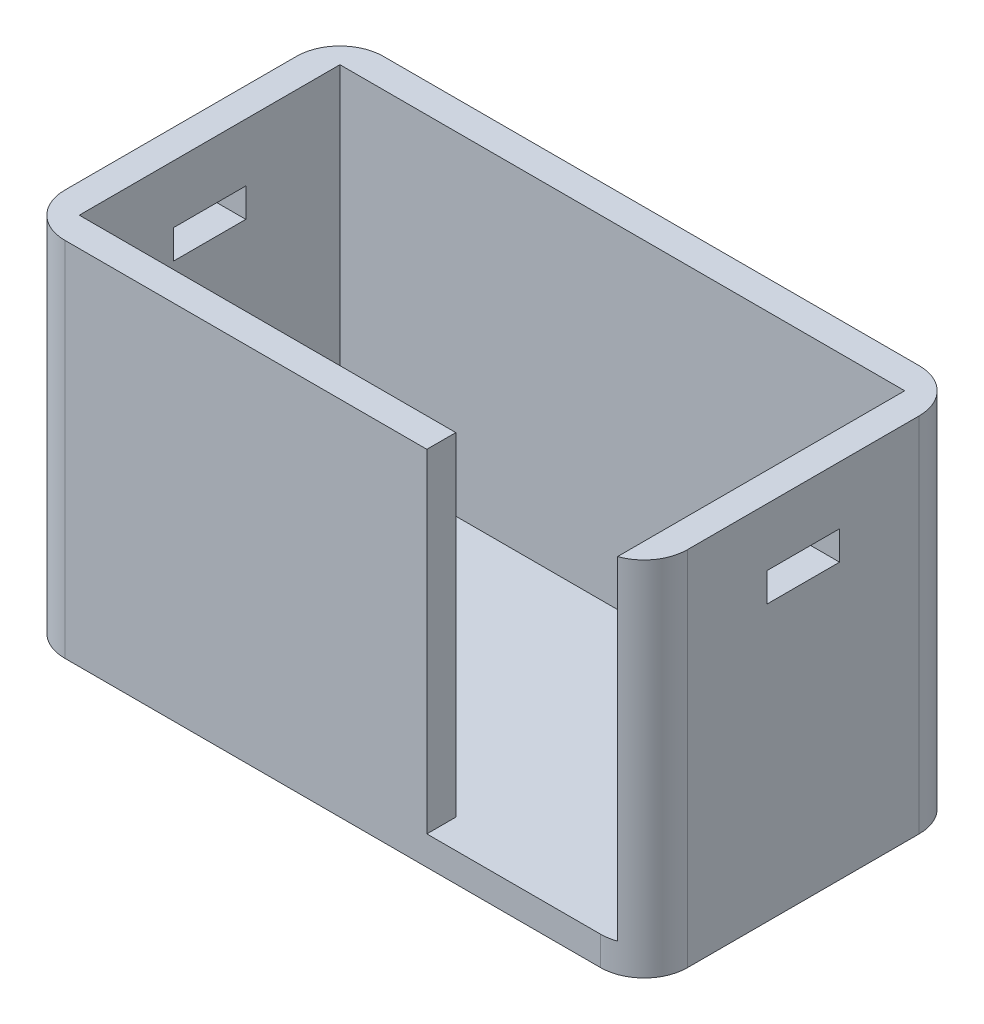
from build123d import *

# Parameters (mm, degrees)
SKETCH1_W           = 43
SKETCH1_H           = 25
SKETCH1_W_2         = 39
SKETCH1_H_2         = 21
BOSS_EXTRUDE1_DEPTH = 18
SKETCH2_W           = 43
SKETCH2_H           = 25
BOSS_EXTRUDE2_DEPTH = 2
SKETCH3_W           = 43
SKETCH3_H           = 20
CUT_EXTRUDE1_DEPTH  = 2
SKETCH5_W           = 28
SKETCH5_H           = 23
BOSS_EXTRUDE3_DEPTH = 2
SKETCH7_W           = 5
SKETCH7_H           = 2
CUT_EXTRUDE3_DEPTH  = 57.5
BOSS_EXTRUDE4_DEPTH = 2
BOSS_EXTRUDE5_DEPTH = 2
SKETCH18_R          = 1.25
CUT_EXTRUDE4_DEPTH  = 2
FILLET4_R           = 3
FILLET5_R           = 3


with BuildPart() as part:
    # Sketch1 → Boss-Extrude1 (new body)
    with BuildSketch(Plane.XY):
        with Locations((19.5, -10.5)):
            Rectangle(SKETCH1_W, SKETCH1_H)
        with Locations((19.5, -10.5)):
            Rectangle(SKETCH1_W_2, SKETCH1_H_2, mode=Mode.SUBTRACT)
    extrude(amount=BOSS_EXTRUDE1_DEPTH)

    # Sketch2 → Boss-Extrude2 (add)
    with BuildSketch(Plane(origin=(0, 0, 0), x_dir=(-1, 0, 0), z_dir=(0, 0, -1))):
        with Locations((-19.5, -10.5)):
            Rectangle(SKETCH2_W, SKETCH2_H)
    extrude(amount=BOSS_EXTRUDE2_DEPTH)

    # Sketch3 → Cut-Extrude1 (cut)
    with BuildSketch(Plane(origin=(0, 2, 0), x_dir=(1, 0, 0), z_dir=(0, 1, 0))):
        with Locations((19.5, -8)):
            Rectangle(SKETCH3_W, SKETCH3_H)
    extrude(amount=-CUT_EXTRUDE1_DEPTH, mode=Mode.SUBTRACT)

    # Sketch5 → Boss-Extrude3 (add)
    with BuildSketch(Plane.XY.offset(18)):
        with Locations((12, -11.5)):
            Rectangle(SKETCH5_W, SKETCH5_H)
    extrude(amount=BOSS_EXTRUDE3_DEPTH)

    # Sketch7 → Cut-Extrude3 (cut, symmetric)
    with BuildSketch(Plane.ZY.offset(-39)):
        with Locations((9, -3)):
            Rectangle(SKETCH7_W, SKETCH7_H)
    extrude(amount=CUT_EXTRUDE3_DEPTH, both=True, mode=Mode.SUBTRACT)

    # Sketch9 → Boss-Extrude4 (add)
    with BuildSketch(Plane.XY.offset(18)):
        Polygon((26, -21), (39, -21), (39, 0), (41, 0), (41, -23), (26, -23), align=None)
    extrude(amount=BOSS_EXTRUDE4_DEPTH)

    # Sketch14 → Boss-Extrude5 (add)
    with BuildSketch(Plane(origin=(0, 0, 0), x_dir=(1, 0, 0), z_dir=(0, 1, 0))):
        Polygon((26, -18), (26, -20), (-2, -20), (-2, 2), (41, 2), (41, -20), (39, -20), (39, 0), (0, 0), (0, -18), align=None)
    extrude(amount=BOSS_EXTRUDE5_DEPTH)

    # Sketch18 → Cut-Extrude4 (cut)
    with BuildSketch(Plane.XZ.offset(23)):
        with Locations((29.5, 7)):
            Circle(SKETCH18_R)
        with Locations((9.5, 7)):
            Circle(SKETCH18_R)
    extrude(amount=-CUT_EXTRUDE4_DEPTH, mode=Mode.SUBTRACT)

    # Fillet4
    fillet4_edges = [part.edges().sort_by_distance(p)[0] for p in [
        (-2, -10.5, -2),
        (41, -10.5, -2),
        (-2, -10.5, 20),
    ]]
    fillet(fillet4_edges, radius=FILLET4_R)

    # Fillet5
    fillet5_edges = [part.edges().sort_by_distance(p)[0] for p in [
        (41, -10.5, 20),
    ]]
    fillet(fillet5_edges, radius=FILLET5_R)


solid = part.part
